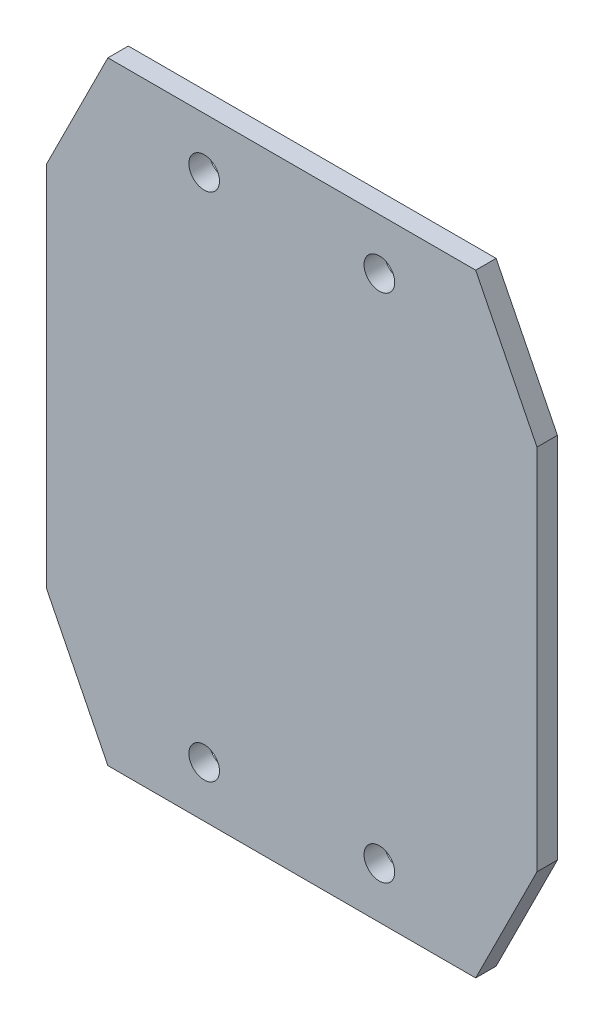
from build123d import *

# Parameters (mm, degrees)
SKETCH2_R           = 7.5
BOSS_EXTRUDE1_DEPTH = 10


with BuildPart() as part:
    # Sketch2 → Boss-Extrude1 (new body)
    with BuildSketch(Plane.XY):
        Polygon((-90, 150), (90, 150), (120, 90), (120, -90), (90, -150), (-90, -150), (-120, -90), (-120, 90), align=None)
        with Locations((42.8625, 125)):
            Circle(SKETCH2_R, mode=Mode.SUBTRACT)
        with Locations((-42.8625, 125)):
            Circle(SKETCH2_R, mode=Mode.SUBTRACT)
        with Locations((-42.8625, -125)):
            Circle(SKETCH2_R, mode=Mode.SUBTRACT)
        with Locations((42.8625, -125)):
            Circle(SKETCH2_R, mode=Mode.SUBTRACT)
    extrude(amount=BOSS_EXTRUDE1_DEPTH)


solid = part.part
